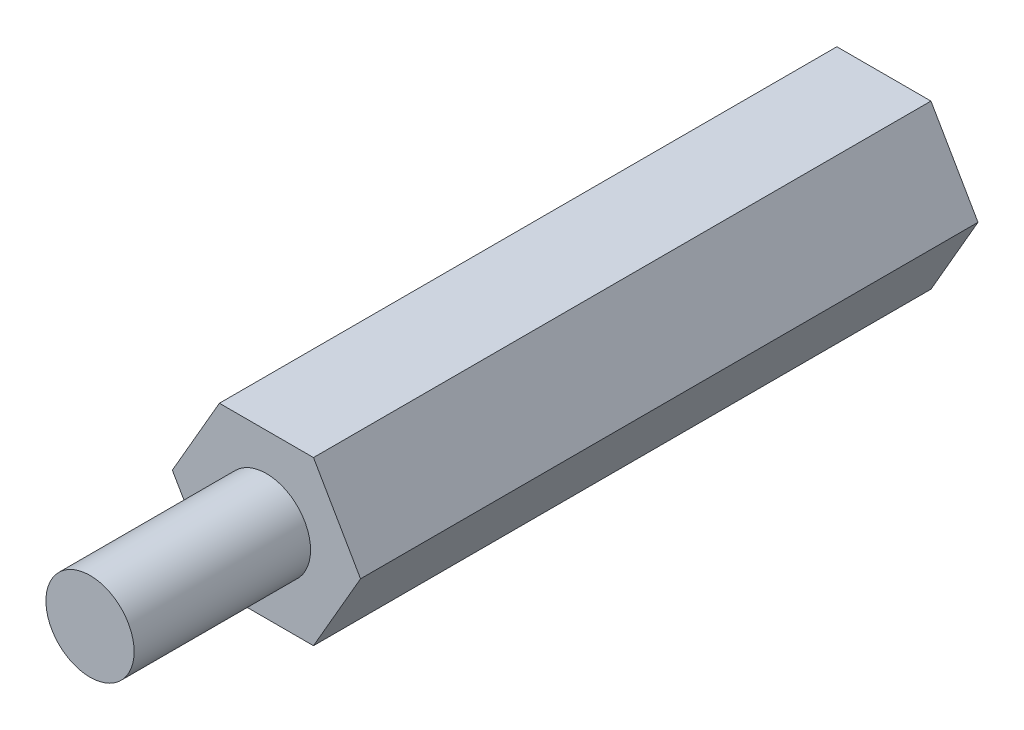
from build123d import *

# Parameters (mm, degrees)
EXTRUDE_1_DEPTH     = 21
SKETCH_4_R          = 1.5
CUT_EXTRUDE_1_DEPTH = 6
SKETCH_5_R          = 1.5
EXTRUDE_2_DEPTH     = 6


with BuildPart() as part:
    # 草图3 → 凸台-拉伸1 (new body)
    with BuildSketch(Plane.XY):
        Polygon((1.6, 2.771281292), (-1.6, 2.771281292), (-3.2, 0), (-1.6, -2.771281292), (1.6, -2.771281292), (3.2, 0), align=None)
    extrude(amount=EXTRUDE_1_DEPTH)

    # 草图4 → 切除-拉伸1 (cut)
    with BuildSketch(Plane(origin=(0, 0, 0), x_dir=(-1, 0, 0), z_dir=(0, 0, -1))):
        Circle(SKETCH_4_R)
    extrude(amount=-CUT_EXTRUDE_1_DEPTH, mode=Mode.SUBTRACT)

    # 草图5 → 凸台-拉伸2 (add)
    with BuildSketch(Plane.XY.offset(21)):
        with Locations(Location((0, 0, 0), (0, 0, 180))):
            Circle(SKETCH_5_R)
    extrude(amount=EXTRUDE_2_DEPTH)


solid = part.part
